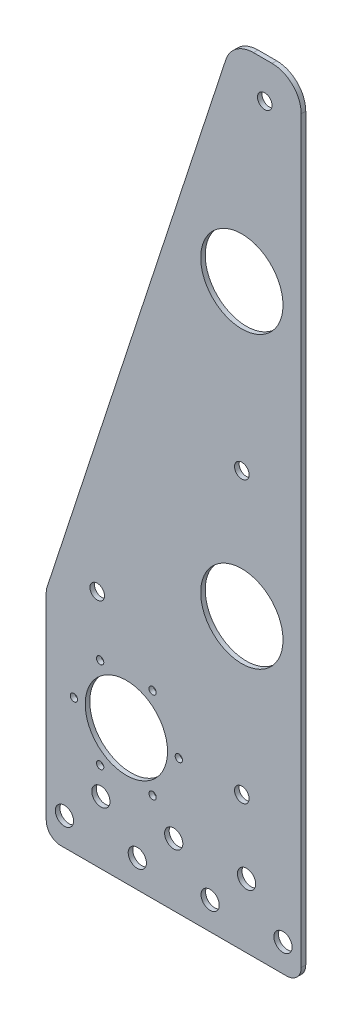
from build123d import *

# Parameters (mm, degrees)
SKETCH1_R           = 14.351
SKETCH1_R_2         = 2.54
SKETCH1_R_3         = 3.175
SKETCH1_R_4         = 1.27
BOSS_EXTRUDE1_DEPTH = 1.5875
SKETCH2_R           = 2.54
BOSS_EXTRUDE2_DEPTH = 1.5875
SKETCH3_R           = 2.54
CUT_EXTRUDE1_DEPTH  = 288.162032059


with BuildPart() as part:
    # Sketch1 → Boss-Extrude1 (new body)
    with BuildSketch(Plane.XY):
        with BuildLine():
            Line((88.9, 212.09), (88.9, 5.08))
            ThreePointArc((88.9, 5.08), (87.412102448, 1.487897552), (83.82, 0))
            Line((83.82, 0), (5.08, 0))
            ThreePointArc((5.08, 0), (1.487897552, 1.487897552), (0, 5.08))
            Line((0, 5.08), (0, 73.969993162))
            ThreePointArc((0, 73.969993162), (0.063384098, 74.769971217), (0.25195468, 75.549986324))
            Line((0.25195468, 75.549986324), (45.969223296, 215.249986324))
            ThreePointArc((45.969223296, 215.249986324), (49.662087504, 220.315906061), (55.625313935, 222.25))
            Line((55.625313935, 222.25), (78.74, 222.25))
            ThreePointArc((78.74, 222.25), (85.924204897, 219.274204897), (88.9, 212.09))
        make_face()
        with Locations((68.199, 201.93)):
            Circle(SKETCH1_R, mode=Mode.SUBTRACT)
        with Locations((68.199, 100.838)):
            Circle(SKETCH1_R, mode=Mode.SUBTRACT)
        with Locations((68.199, 144.78)):
            Circle(SKETCH1_R_2, mode=Mode.SUBTRACT)
        with Locations((68.199, 46.99)):
            Circle(SKETCH1_R_2, mode=Mode.SUBTRACT)
        with Locations((27.94, 46.99)):
            Circle(SKETCH1_R, mode=Mode.SUBTRACT)
        with Locations((6.35, 9.652)):
            Circle(SKETCH1_R_3, mode=Mode.SUBTRACT)
        with Locations((31.75, 9.652)):
            Circle(SKETCH1_R_3, mode=Mode.SUBTRACT)
        with Locations((57.15, 9.652)):
            Circle(SKETCH1_R_3, mode=Mode.SUBTRACT)
        with Locations((82.55, 9.652)):
            Circle(SKETCH1_R_3, mode=Mode.SUBTRACT)
        with Locations(Location((69.85, 22.352, 0), (0, 0, 180))):
            Circle(SKETCH1_R_3, mode=Mode.SUBTRACT)
        with Locations(Location((44.45, 21.844, 0), (0, 0, 180))):
            Circle(SKETCH1_R_3, mode=Mode.SUBTRACT)
        with Locations(Location((19.05, 21.844, 0), (0, 0, 180))):
            Circle(SKETCH1_R_3, mode=Mode.SUBTRACT)
        with Locations((46.228, 46.99)):
            Circle(SKETCH1_R_4, mode=Mode.SUBTRACT)
        with Locations((37.084, 31.152127416)):
            Circle(SKETCH1_R_4, mode=Mode.SUBTRACT)
        with Locations((18.796, 31.152127416)):
            Circle(SKETCH1_R_4, mode=Mode.SUBTRACT)
        with Locations((9.652, 46.99)):
            Circle(SKETCH1_R_4, mode=Mode.SUBTRACT)
        with Locations((18.796, 62.827872584)):
            Circle(SKETCH1_R_4, mode=Mode.SUBTRACT)
        with Locations((37.084, 62.827872584)):
            Circle(SKETCH1_R_4, mode=Mode.SUBTRACT)
    extrude(amount=BOSS_EXTRUDE1_DEPTH)

    # Sketch2 → Boss-Extrude2 (add)
    with BuildSketch(Plane.XY.offset(1.5875)):
        with BuildLine():
            Line((45.969223296, 215.249986324), (62.593684611, 266.049986324))
            ThreePointArc((62.593684611, 266.049986324), (66.286548819, 271.115906061), (72.24977525, 273.05))
            Line((72.24977525, 273.05), (78.74, 273.05))
            ThreePointArc((78.74, 273.05), (85.924204897, 270.074204897), (88.9, 262.89))
            Line((88.9, 262.89), (88.9, 212.09))
            Line((88.9, 212.09), (78.74, 222.25))
            Line((78.74, 222.25), (55.625313935, 222.25))
            Line((55.625313935, 222.25), (45.969223296, 215.249986324))
        make_face()
        with Locations((76.2, 260.35)):
            Circle(SKETCH2_R, mode=Mode.SUBTRACT)
    extrude(amount=-BOSS_EXTRUDE2_DEPTH)

    # Sketch3 → Cut-Extrude1 (cut, through all)
    with BuildSketch(Plane.XY.offset(1.5875)):
        with Locations((17.78, 83.058)):
            Circle(SKETCH3_R)
    extrude(amount=-CUT_EXTRUDE1_DEPTH, mode=Mode.SUBTRACT)


solid = part.part
